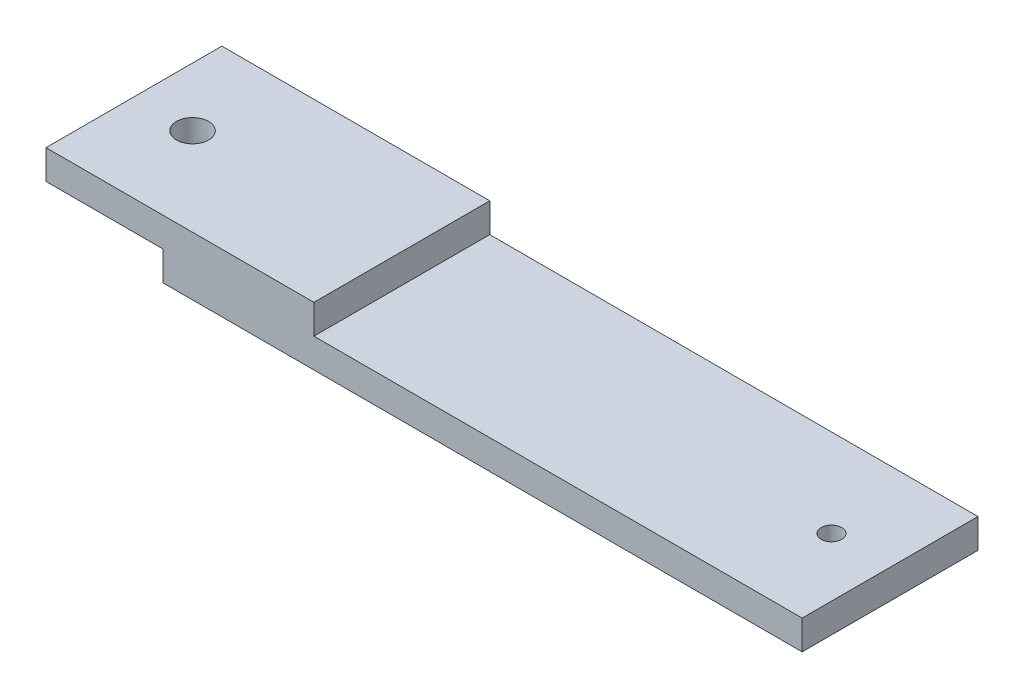
from build123d import *

# Parameters (mm, degrees)
SKETCH_1_W          = 129
SKETCH_1_H          = 30
SKETCH_1_R          = 2.75
SKETCH_1_R_2        = 1.75
EXTRUDE_1_DEPTH     = 10
SKETCH_2_W          = 20
SKETCH_2_H          = 5
SKETCH_2_W_2        = 83.295582585
CUT_EXTRUDE_1_DEPTH = 110.532870251


with BuildPart() as part:
    # 草图1 → 凸台-拉伸1 (new body)
    with BuildSketch(Plane(origin=(0, 0, 0), x_dir=(1, 0, 0), z_dir=(0, 1, 0))):
        with Locations((40.368725869, -2.113899614)):
            Rectangle(SKETCH_1_W, SKETCH_1_H)
        with Locations(Location((-14.131274131, -2.113899614, 0), (0, 0, 270))):
            Circle(SKETCH_1_R, mode=Mode.SUBTRACT)
        with Locations(Location((94.868725869, -2.113899614, 0), (0, 0, 270))):
            Circle(SKETCH_1_R_2, mode=Mode.SUBTRACT)
    extrude(amount=EXTRUDE_1_DEPTH)

    # 草图2 → 切除-拉伸1 (cut, through all)
    with BuildSketch(Plane.XY.offset(17.113899614)):
        with Locations((-14.131274131, 2.5)):
            Rectangle(SKETCH_2_W, SKETCH_2_H)
        with Locations((63.220934576, 7.5)):
            Rectangle(SKETCH_2_W_2, SKETCH_2_H)
    extrude(amount=-CUT_EXTRUDE_1_DEPTH, mode=Mode.SUBTRACT)


solid = part.part
